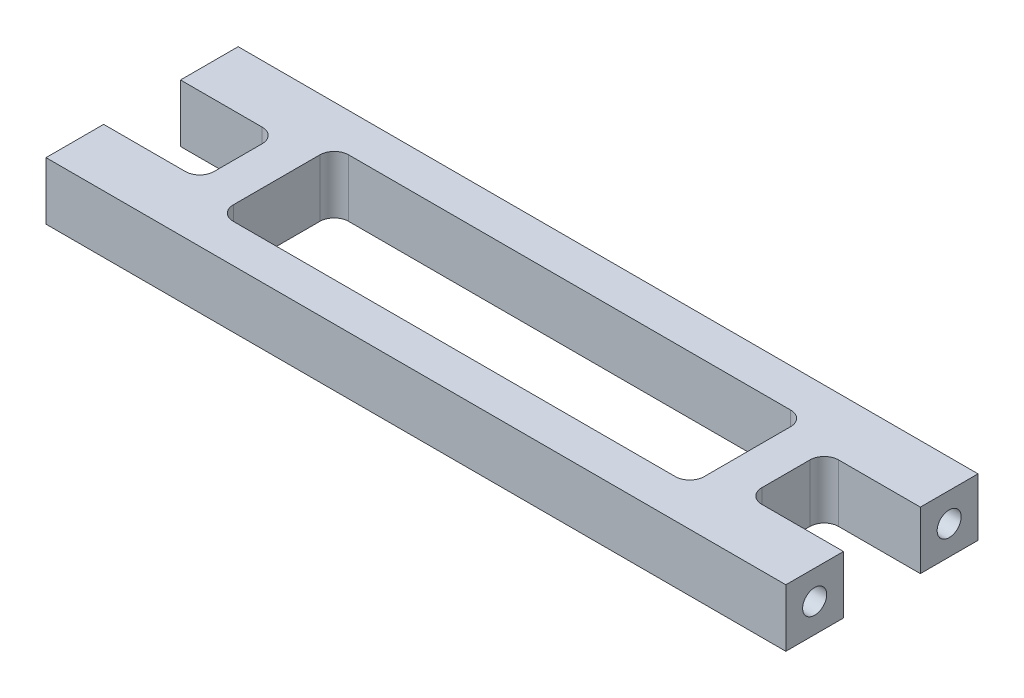
from build123d import *

# Parameters (mm, degrees)
SKETCH1_W                   = 77
SKETCH1_H                   = 20
BOSS_EXTRUDE1_DEPTH         = 6
TAP_DRILL_FOR_M3_TAP1_D     = 2.5
TAP_DRILL_FOR_M3_TAP1_DEPTH = 10
TAP_DRILL_FOR_M3_TAP1_TIP   = 0.751075774
TAP_DRILL_FOR_M3_TAP2_D     = 2.5
TAP_DRILL_FOR_M3_TAP2_DEPTH = 10
TAP_DRILL_FOR_M3_TAP2_TIP   = 0.751075774
CUT_EXTRUDE1_REACH          = 81.781
SKETCH7_W                   = 10
SKETCH7_H                   = 8
SKETCH7_W_2                 = 49
SKETCH7_H_2                 = 12
FILLET1_R                   = 1.5


with BuildPart() as part:
    # Sketch1 → Boss-Extrude1 (new body)
    with BuildSketch(Plane(origin=(0, 0, 0), x_dir=(1, 0, 0), z_dir=(0, 1, 0))):
        with Locations((38.5, 10)):
            Rectangle(SKETCH1_W, SKETCH1_H)
    extrude(amount=BOSS_EXTRUDE1_DEPTH)

    # Tap Drill for M3 Tap1
    with Locations(Plane.ZY):
        with Locations((-17, 3), (-3, 3)):
            Hole(TAP_DRILL_FOR_M3_TAP1_D / 2, depth=TAP_DRILL_FOR_M3_TAP1_DEPTH)
            with Locations((0, 0, -(TAP_DRILL_FOR_M3_TAP1_DEPTH + TAP_DRILL_FOR_M3_TAP1_TIP / 2))):  # 118° drill point
                Cone(0, TAP_DRILL_FOR_M3_TAP1_D / 2, TAP_DRILL_FOR_M3_TAP1_TIP, mode=Mode.SUBTRACT)

    # Tap Drill for M3 Tap2
    with Locations(Plane(origin=(77, 0, 0), x_dir=(0, 0, -1), z_dir=(1, 0, 0))):
        with Locations((3, 3), (17, 3)):
            Hole(TAP_DRILL_FOR_M3_TAP2_D / 2, depth=TAP_DRILL_FOR_M3_TAP2_DEPTH)
            with Locations((0, 0, -(TAP_DRILL_FOR_M3_TAP2_DEPTH + TAP_DRILL_FOR_M3_TAP2_TIP / 2))):  # 118° drill point
                Cone(0, TAP_DRILL_FOR_M3_TAP2_D / 2, TAP_DRILL_FOR_M3_TAP2_TIP, mode=Mode.SUBTRACT)

    # Sketch7 → Cut-Extrude1 (cut, up to next)
    with BuildSketch(Plane(origin=(0, 6, 0), x_dir=(1, 0, 0), z_dir=(0, 1, 0)), mode=Mode.PRIVATE) as cut_extrude1_sk1:
        with Locations((5, 10)):
            Rectangle(SKETCH7_W, SKETCH7_H)
    cut_extrude1_tool1 = extrude(cut_extrude1_sk1.sketch, amount=-CUT_EXTRUDE1_REACH, mode=Mode.PRIVATE) & part.part
    # Sketch7 → Cut-Extrude1 (cut, up to next)
    with BuildSketch(Plane(origin=(0, 6, 0), x_dir=(1, 0, 0), z_dir=(0, 1, 0)), mode=Mode.PRIVATE) as cut_extrude1_sk2:
        with Locations((38.5, 10)):
            Rectangle(SKETCH7_W_2, SKETCH7_H_2)
    cut_extrude1_tool2 = extrude(cut_extrude1_sk2.sketch, amount=-CUT_EXTRUDE1_REACH, mode=Mode.PRIVATE) & part.part
    # Sketch7 → Cut-Extrude1 (cut, up to next)
    with BuildSketch(Plane(origin=(0, 6, 0), x_dir=(1, 0, 0), z_dir=(0, 1, 0)), mode=Mode.PRIVATE) as cut_extrude1_sk3:
        with Locations((72, 10)):
            Rectangle(SKETCH7_W, SKETCH7_H)
    cut_extrude1_tool3 = extrude(cut_extrude1_sk3.sketch, amount=-CUT_EXTRUDE1_REACH, mode=Mode.PRIVATE) & part.part
    add(cut_extrude1_tool1.solids().sort_by_distance((5, 6, -10))[0], mode=Mode.SUBTRACT)
    add(cut_extrude1_tool2.solids().sort_by_distance((38.5, 6, -10))[0], mode=Mode.SUBTRACT)
    add(cut_extrude1_tool3.solids().sort_by_distance((72, 6, -10))[0], mode=Mode.SUBTRACT)

    # Fillet1
    fillet1_edges = [part.edges().sort_by_distance(p)[0] for p in [
        (10, 3, -14),
        (10, 3, -6),
        (14, 3, -4),
        (14, 3, -16),
        (63, 3, -16),
        (63, 3, -4),
        (67, 3, -6),
        (67, 3, -14),
    ]]
    fillet(fillet1_edges, radius=FILLET1_R)


solid = part.part
